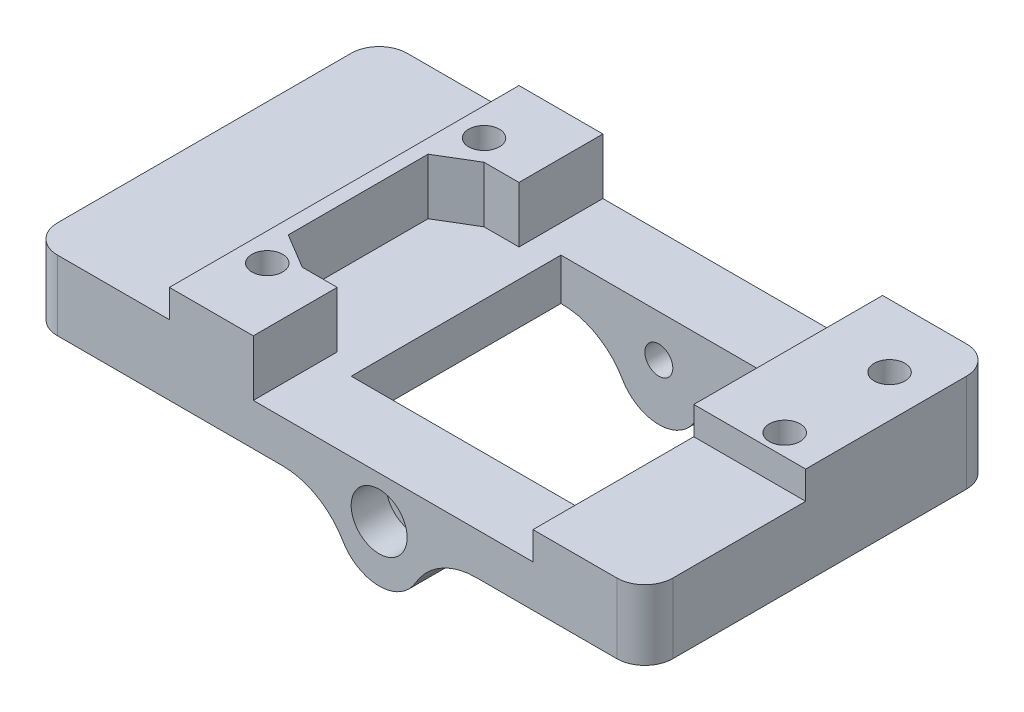
from build123d import *
from build123d.topology import SkipClean

# Parameters (mm, degrees)
SKETCH_1_W           = 50
SKETCH_1_H           = 25
EXTRUDE_1_DEPTH      = 7
EXTRUDE_2_DEPTH      = 5
SKETCH_3_R           = 1
CUT_EXTRUDE_1_DEPTH  = 37.041642582
SKETCH_5_W           = 6
SKETCH_5_H           = 25
CUT_EXTRUDE_5_DEPTH  = 31.037476592
SKETCH_6_R           = 2
CUT_EXTRUDE_6_DEPTH  = 2.5
FILLET_2_R           = 2
FILLET_3_R           = 5
SKETCH_8_R           = 1.1
CUT_EXTRUDE_9_DEPTH  = 31.037476592
CUT_EXTRUDE_4_DEPTH  = 4
SKETCH_7_W           = 16
SKETCH_7_H           = 15
CUT_EXTRUDE_7_DEPTH  = 29.814059068
SKETCH_10_R          = 3
CUT_EXTRUDE_11_DEPTH = 3
SKETCH_12_R          = 2
EXTRUDE_3_DEPTH      = 5
SKETCH_13_W          = 10
SKETCH_13_H          = 25
SKETCH_13_W_2        = 8
SKETCH_13_H_2        = 11.5
CUT_EXTRUDE_12_DEPTH = 2


with BuildPart() as part:
    # 草图1 → 凸台-拉伸1 (new body)
    with BuildSketch(Plane(origin=(0, 0, 0), x_dir=(1, 0, 0), z_dir=(0, 1, 0))):
        Rectangle(SKETCH_1_W, SKETCH_1_H)
    extrude(amount=EXTRUDE_1_DEPTH)

    # 草图2 → 凸台-拉伸2 (add)
    with BuildSketch(Plane.XY.offset(12.5)):
        with BuildLine():
            Line((-2.828427125, 0), (2.828427125, 0))
            ThreePointArc((2.828427125, 0), (0, -4), (-2.828427125, 0))
        make_face()
    extrude_2 = extrude(amount=-EXTRUDE_2_DEPTH)

    # 草图3 → 切除-拉伸1 (cut, through all)
    with BuildSketch(Plane.XY.offset(12.5)):
        Circle(SKETCH_3_R)
    cut_extrude_1 = extrude(amount=-CUT_EXTRUDE_1_DEPTH, mode=Mode.SUBTRACT)

    # 镜向1: 凸台-拉伸2, 切除-拉伸1 across plane
    with SkipClean():  # the faces are left unmerged after this step: merging them gives an invalid solid
        add(extrude_2.mirror(Plane.XY))
        add(cut_extrude_1.mirror(Plane.XY), mode=Mode.SUBTRACT)

    # 草图5 → 切除-拉伸5 (cut, through all)
    with SkipClean():  # the faces are left unmerged after this step: merging them gives an invalid solid
        with BuildSketch(Plane(origin=(0, 7, 0), x_dir=(1, 0, 0), z_dir=(0, 1, 0))):
            with Locations((22, 0)):
                Rectangle(SKETCH_5_W, SKETCH_5_H)
        extrude(amount=-CUT_EXTRUDE_5_DEPTH, mode=Mode.SUBTRACT)

    # 草图6 → 切除-拉伸6 (cut)
    with SkipClean():  # the faces are left unmerged after this step: merging them gives an invalid solid
        with BuildSketch(Plane.XY.offset(12.5)):
            Circle(SKETCH_6_R)
        extrude(amount=-CUT_EXTRUDE_6_DEPTH, mode=Mode.SUBTRACT)

    # 圆角2
    fillet_2_edges = [part.edges().sort_by_distance(p)[0] for p in [
        (19, 3.5, 12.5),
        (19, 3.5, -12.5),
        (-25, 3.5, 12.5),
        (-25, 3.5, -12.5),
    ]]
    fillet(fillet_2_edges, radius=FILLET_2_R)

    # 圆角3
    fillet_3_edges = [part.edges().sort_by_distance(p)[0] for p in [
        (2.828427125, 0, 10),
        (-2.828427125, 0, 10),
        (2.828427125, 0, -10),
        (-2.828427125, 0, -10),
    ]]
    fillet(fillet_3_edges, radius=FILLET_3_R)

    # 草图8 → 切除-拉伸9 (cut, through all)
    with SkipClean():  # the faces are left unmerged after this step: merging them gives an invalid solid
        with BuildSketch(Plane(origin=(0, 7, 0), x_dir=(1, 0, 0), z_dir=(0, 1, 0))):
            with Locations(Location((-13, 8, 0), (0, 0, 270))):
                Circle(SKETCH_8_R)
            with Locations(Location((-13, -7.5, 0), (0, 0, 270))):
                Circle(SKETCH_8_R)
            with Locations(Location((16, 8, 0), (0, 0, 270))):
                Circle(SKETCH_8_R)
            with Locations(Location((16, 0.5, 0), (0, 0, 270))):
                Circle(SKETCH_8_R)
        extrude(amount=-CUT_EXTRUDE_9_DEPTH, mode=Mode.SUBTRACT)

    # 草图4 → 切除-拉伸4 (cut)
    with SkipClean():  # the faces are left unmerged after this step: merging them gives an invalid solid
        with BuildSketch(Plane(origin=(0, 7, 0), x_dir=(1, 0, 0), z_dir=(0, 1, 0))):
            Polygon((-9, -12.5), (11, -12.5), (11, 12.5), (-9, 12.5), (-9, 6.5), (-11.5, 6.5), (-14, 5), (-14, -5), (-11.5, -6.5), (-9, -6.5), align=None)
        extrude(amount=-CUT_EXTRUDE_4_DEPTH, mode=Mode.SUBTRACT)

    # 草图7 → 切除-拉伸7 (cut, through all)
    with SkipClean():  # the faces are left unmerged after this step: merging them gives an invalid solid
        with BuildSketch(Plane(origin=(0, 3, 0), x_dir=(1, 0, 0), z_dir=(0, 1, 0))):
            with Locations((1, 0)):
                Rectangle(SKETCH_7_W, SKETCH_7_H)
        extrude(amount=-CUT_EXTRUDE_7_DEPTH, mode=Mode.SUBTRACT)

    # 草图10 → 切除-拉伸11 (cut)
    with SkipClean():  # the faces are left unmerged after this step: merging them gives an invalid solid
        with BuildSketch(Plane.XZ):
            with Locations(Location((-20, 0, 0), (0, 0, 270))):
                Circle(SKETCH_10_R)
        extrude(amount=-CUT_EXTRUDE_11_DEPTH, mode=Mode.SUBTRACT)

    # 草图12 → 凸台-拉伸3 (add)
    with SkipClean():  # the faces are left unmerged after this step: merging them gives an invalid solid
        with BuildSketch(Plane.XZ.offset(-3)):
            with Locations(Location((-20, 0, 0), (0, 0, 270))):
                Circle(SKETCH_12_R)
        extrude(amount=EXTRUDE_3_DEPTH)

    # 草图13 → 切除-拉伸12 (cut)
    with SkipClean():  # the faces are left unmerged after this step: merging them gives an invalid solid
        with BuildSketch(Plane(origin=(0, 7, 0), x_dir=(1, 0, 0), z_dir=(0, 1, 0))):
            with Locations((-20, 0)):
                Rectangle(SKETCH_13_W, SKETCH_13_H)
            with Locations((15, -6.75)):
                Rectangle(SKETCH_13_W_2, SKETCH_13_H_2)
        extrude(amount=-CUT_EXTRUDE_12_DEPTH, mode=Mode.SUBTRACT)


solid = part.part
